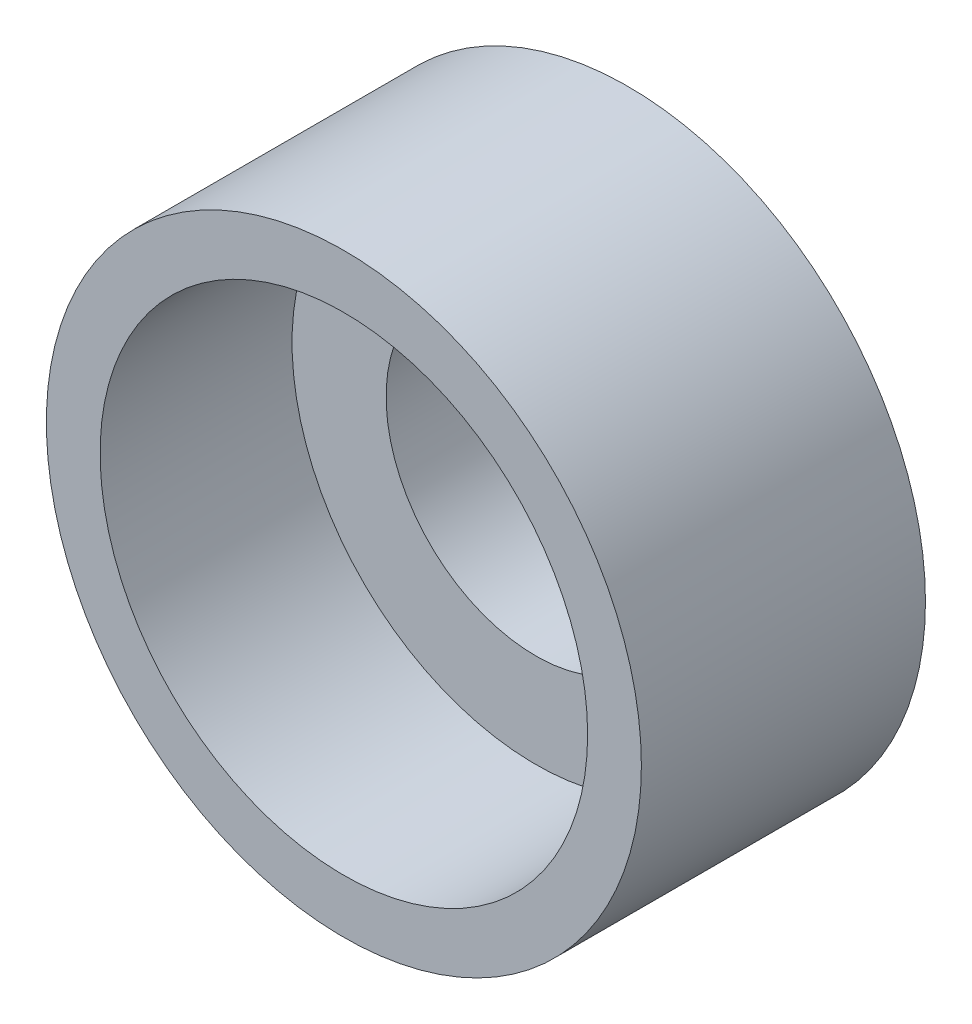
from build123d import *

# Parameters (mm, degrees)
SKETCH1_R           = 3.875
SKETCH1_R_2         = 1.95
BOSS_EXTRUDE1_DEPTH = 1.2
SKETCH2_R           = 3.875
SKETCH2_R_2         = 3.175
BOSS_EXTRUDE2_DEPTH = 2.5


with BuildPart() as part:
    # Sketch1 → Boss-Extrude1 (new body)
    with BuildSketch(Plane(origin=(0, 0, 0), x_dir=(0, 1, 0), z_dir=(0, 0, 1))):
        Circle(SKETCH1_R)
        Circle(SKETCH1_R_2, mode=Mode.SUBTRACT)
    extrude(amount=BOSS_EXTRUDE1_DEPTH)

    # Sketch2 → Boss-Extrude2 (add)
    with BuildSketch(Plane.XY.offset(1.2)):
        Circle(SKETCH2_R)
        Circle(SKETCH2_R_2, mode=Mode.SUBTRACT)
    extrude(amount=BOSS_EXTRUDE2_DEPTH)


solid = part.part
